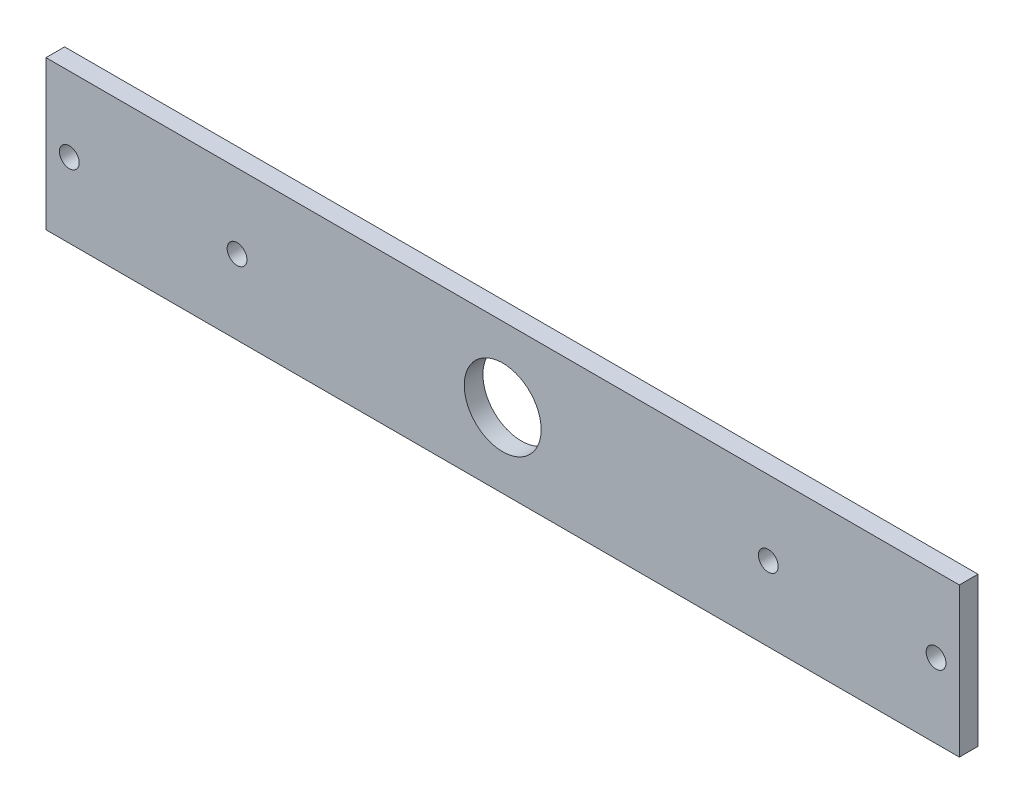
from build123d import *

# Parameters (mm, degrees)
SKETCH1_W               = 311.15
SKETCH1_H               = 50.8
BOSS_EXTRUDE1_DEPTH     = 6.35
F_1_CLEARANCE_HOLE1_D   = 26.19248
F_1_4_CLEARANCE_HOLE1_D = 6.7564


with BuildPart() as part:
    # Sketch1 → Boss-Extrude1 (new body)
    with BuildSketch(Plane.XY):
        Rectangle(SKETCH1_W, SKETCH1_H)
    extrude(amount=BOSS_EXTRUDE1_DEPTH)

    # 1 Clearance Hole1 (through all)
    with Locations(Plane.XY.offset(6.35)):
        with Locations((0, 0)):
            Hole(F_1_CLEARANCE_HOLE1_D / 2)

    # 1/4 Clearance Hole1 (through all)
    with Locations(Plane.XY.offset(6.35)):
        with Locations((-147.6375, 0), (-90.4875, 0)):
            f_1_4_clearance_hole1 = Hole(F_1_4_CLEARANCE_HOLE1_D / 2)

    # Mirror1: 1/4 Clearance Hole1 across plane
    add(f_1_4_clearance_hole1.mirror(Plane(origin=(0, 0, 0), x_dir=(0, 0, 1), z_dir=(1, 0, 0))), mode=Mode.SUBTRACT)


solid = part.part
